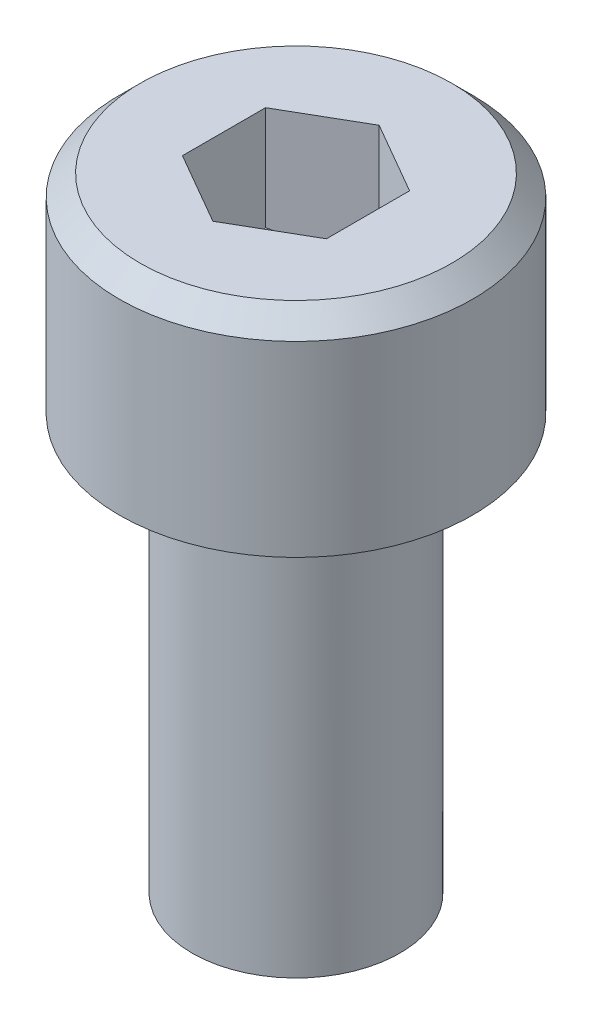
from build123d import *

# Parameters (mm, degrees)
CROQUIS4_R              = 4.25
SALIENTE_EXTRUIR3_DEPTH = 5
CHAFL_N2_SIZE           = 0.5
CROQUIS6_5_R            = 2.5
SALIENTE_EXTRUIR7_DEPTH = 10


with BuildPart() as part:
    # Croquis4 → Saliente-Extruir3 (new body)
    with BuildSketch(Plane(origin=(0, 0, 0), x_dir=(1, 0, 0), z_dir=(0, 1, 0))):
        Circle(CROQUIS4_R)
        Polygon((0, 2), (-1.732050808, 1), (-1.732050808, -1), (0, -2), (1.732050808, -1), (1.732050808, 1), align=None, mode=Mode.SUBTRACT)
    extrude(amount=SALIENTE_EXTRUIR3_DEPTH)

    # Chaflán2
    chafl_n2_edges = [part.edges().sort_by_distance(p)[0] for p in [
        (-4.25, 5, 0),
    ]]
    chamfer(chafl_n2_edges, length=CHAFL_N2_SIZE)

    # Croquis5 → Revolución2 (revolve)
    with BuildSketch(Plane.XY):
        Polygon((0, 0), (0, 1.345299462), (2, 2.5), (4.25, 2.5), (4.25, 0), align=None)
    revolve(axis=Axis((0, 0, 0), (0, 1, 0)))

    # Croquis6<5> → Saliente-Extruir7 (add)
    with BuildSketch(Plane.XZ):
        Circle(CROQUIS6_5_R)
    extrude(amount=SALIENTE_EXTRUIR7_DEPTH)


solid = part.part
